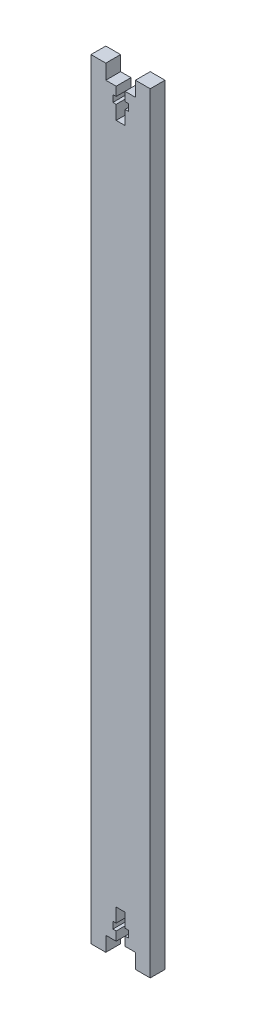
from build123d import *

# Parameters (mm, degrees)
BOSS_EXTRUDE1_DEPTH = 5


with BuildPart() as part:
    # Sketch1 → Boss-Extrude1 (new body)
    with BuildSketch(Plane.XY):
        Polygon((-11.601867621, 9), (-15.101867621, 9), (-15.101867621, 4), (-20.101867621, 4), (-20.101867621, 9), (-20.101867621, 259), (-20.101867621, 264), (-15.101867621, 264), (-15.101867621, 259), (-11.601867621, 259), (-11.601867621, 256), (-12.701867621, 256), (-12.701867621, 253.7), (-11.601867621, 253.7), (-11.601867621, 249), (-8.601867621, 249), (-8.601867621, 253.7), (-7.501867621, 253.7), (-7.501867621, 256), (-8.601867621, 256), (-8.601867621, 259), (-5.101867621, 259), (-5.101867621, 264), (-0.101867621, 264), (-0.101867621, 259), (-0.101867621, 9), (-0.101867621, 4), (-5.101867621, 4), (-5.101867621, 9), (-8.601867621, 9), (-8.601867621, 12), (-7.501867621, 12), (-7.501867621, 14.3), (-8.601867621, 14.3), (-8.601867621, 19), (-11.601867621, 19), (-11.601867621, 14.3), (-12.701867621, 14.3), (-12.701867621, 12), (-11.601867621, 12), align=None)
    extrude(amount=BOSS_EXTRUDE1_DEPTH)


solid = part.part
